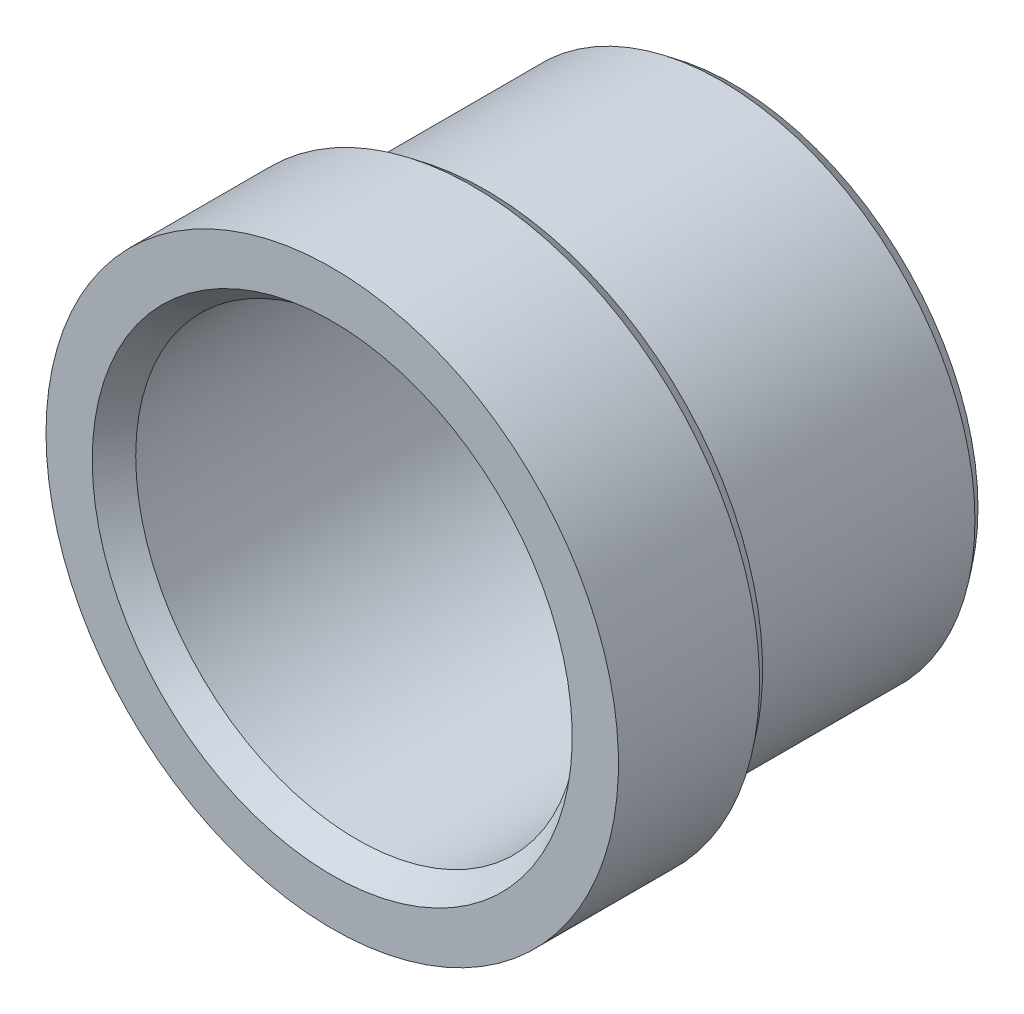
from build123d import *
from OCP.BRepFilletAPI import BRepFilletAPI_MakeChamfer

# Parameters (mm, degrees)
CHAMFER2_SIZE  = 0.5334
CHAMFER2_SIZE2 = 0.40194573


with BuildPart() as part:
    # Sketch2 → Revolve1 (revolve)
    with BuildSketch(Plane(origin=(0, 0, 0), x_dir=(0, 0, -1), z_dir=(1, 0, 0)), mode=Mode.PRIVATE) as revolve1_sk:
        Polygon((8.636, 9.525), (8.636, 10.922), (-2.032, 10.922), (-2.032, 12.319), (-8.636, 12.319), (-8.636, 10.328891461), (-7.5692, 9.525), align=None)
    revolve(revolve1_sk.sketch.rotate(Axis((0, 0, -8.636), (0, 0, 1)), 90), axis=Axis((0, 0, -8.636), (0, 0, 1)))

    # Chamfer2: one chamfer whose edges measure the first distance from different faces: ONE call of the kernel's chamfer builder (chamfer() names one face for all edges)
    chamfer2_edges_1 = [part.edges().sort_by_distance(p)[0] for p in [
        (12.319, 0, 2.032),
    ]]
    chamfer2_side_1 = [part.faces().sort_by_distance(p)[0] for p in [
        (12.319, 0, 5.334),
    ]]
    chamfer2_edges_2 = [part.edges().sort_by_distance(p)[0] for p in [
        (10.922, 0, -8.636),
    ]]
    chamfer2_side_2 = [part.faces().sort_by_distance(p)[0] for p in [
        (10.922, 0, -3.302),
    ]]
    chamfer2 = BRepFilletAPI_MakeChamfer(part.part.solid().wrapped)
    for e in chamfer2_edges_1:
        chamfer2.Add(CHAMFER2_SIZE, CHAMFER2_SIZE2, e.wrapped, chamfer2_side_1[0].wrapped)  # the first distance lies on this face
    for e in chamfer2_edges_2:
        chamfer2.Add(CHAMFER2_SIZE, CHAMFER2_SIZE2, e.wrapped, chamfer2_side_2[0].wrapped)  # the first distance lies on this face
    add(Compound.cast(chamfer2.Shape()), mode=Mode.REPLACE)


solid = part.part
